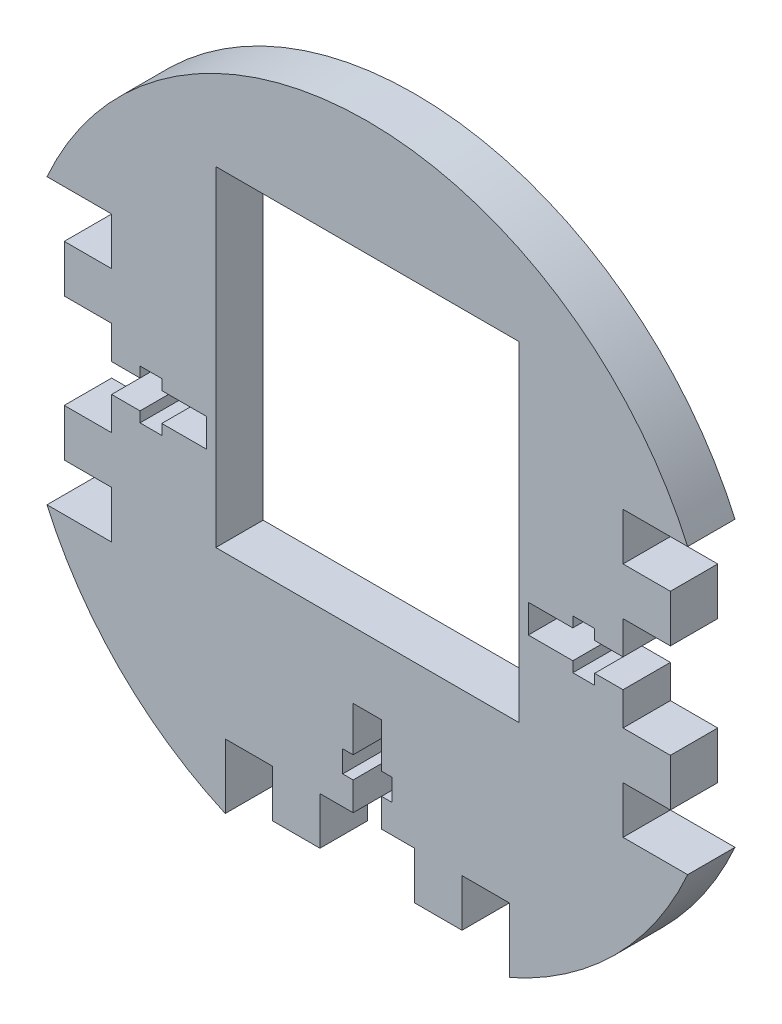
from build123d import *

# Parameters (mm, degrees)
SKETCH1_W           = 32
SKETCH1_H           = 34.840049923
BOSS_EXTRUDE1_DEPTH = 5


with BuildPart() as part:
    # Sketch1 → Boss-Extrude1 (new body)
    with BuildSketch(Plane.XY):
        with BuildLine():
            Line((-27, 10), (-27, 15))
            Line((-27, 15), (-33.823069051, 15))
            ThreePointArc((-33.823069051, 15), (0, 37), (33.823069051, 15))
            Line((33.823069051, 15), (27, 15))
            Line((27, 15), (27, 10))
            Line((27, 10), (32, 10))
            Line((32, 10), (32, 5))
            Line((32, 5), (27, 5))
            Line((27, 5), (27, 1.5))
            Line((27, 1.5), (24, 1.5))
            Line((24, 1.5), (24, 2.6))
            Line((24, 2.6), (21.7, 2.6))
            Line((21.7, 2.6), (21.7, 1.5))
            Line((21.7, 1.5), (17, 1.5))
            Line((17, 1.5), (17, -1.5))
            Line((17, -1.5), (21.7, -1.5))
            Line((21.7, -1.5), (21.7, -2.6))
            Line((21.7, -2.6), (24, -2.6))
            Line((24, -2.6), (24, -1.5))
            Line((24, -1.5), (27, -1.5))
            Line((27, -1.5), (27, -5))
            Line((27, -5), (32, -5))
            Line((32, -5), (32, -10))
            Line((32, -10), (27, -10))
            Line((27, -10), (27, -15))
            Line((27, -15), (33.823069051, -15))
            ThreePointArc((33.823069051, -15), (26.162950904, -26.162950904), (15, -33.823069051))
            Line((15, -33.823069051), (15, -27))
            Line((15, -27), (10, -27))
            Line((10, -27), (10, -32))
            Line((10, -32), (5, -32))
            Line((5, -32), (5, -27))
            Line((5, -27), (1.5, -27))
            Line((1.5, -27), (1.5, -24))
            Line((1.5, -24), (2.6, -24))
            Line((2.6, -24), (2.6, -21.7))
            Line((2.6, -21.7), (1.5, -21.7))
            Line((1.5, -21.7), (1.5, -17))
            Line((1.5, -17), (-1.5, -17))
            Line((-1.5, -17), (-1.5, -21.7))
            Line((-1.5, -21.7), (-2.6, -21.7))
            Line((-2.6, -21.7), (-2.6, -24))
            Line((-2.6, -24), (-1.5, -24))
            Line((-1.5, -24), (-1.5, -27))
            Line((-1.5, -27), (-5, -27))
            Line((-5, -27), (-5, -32))
            Line((-5, -32), (-10, -32))
            Line((-10, -32), (-10, -27))
            Line((-10, -27), (-15, -27))
            Line((-15, -27), (-15, -33.823069051))
            ThreePointArc((-15, -33.823069051), (-26.162950904, -26.162950904), (-33.823069051, -15))
            Line((-33.823069051, -15), (-27, -15))
            Line((-27, -15), (-27, -10))
            Line((-27, -10), (-32, -10))
            Line((-32, -10), (-32, -5))
            Line((-32, -5), (-27, -5))
            Line((-27, -5), (-27, -1.5))
            Line((-27, -1.5), (-24, -1.5))
            Line((-24, -1.5), (-24, -2.6))
            Line((-24, -2.6), (-21.7, -2.6))
            Line((-21.7, -2.6), (-21.7, -1.5))
            Line((-21.7, -1.5), (-17, -1.5))
            Line((-17, -1.5), (-17, 1.5))
            Line((-17, 1.5), (-21.7, 1.5))
            Line((-21.7, 1.5), (-21.7, 2.6))
            Line((-21.7, 2.6), (-24, 2.6))
            Line((-24, 2.6), (-24, 1.5))
            Line((-24, 1.5), (-27, 1.5))
            Line((-27, 1.5), (-27, 5))
            Line((-27, 5), (-32, 5))
            Line((-32, 5), (-32, 10))
            Line((-32, 10), (-27, 10))
        make_face()
        with Locations((0, 7.420024962)):
            Rectangle(SKETCH1_W, SKETCH1_H, mode=Mode.SUBTRACT)
    extrude(amount=BOSS_EXTRUDE1_DEPTH)


solid = part.part
